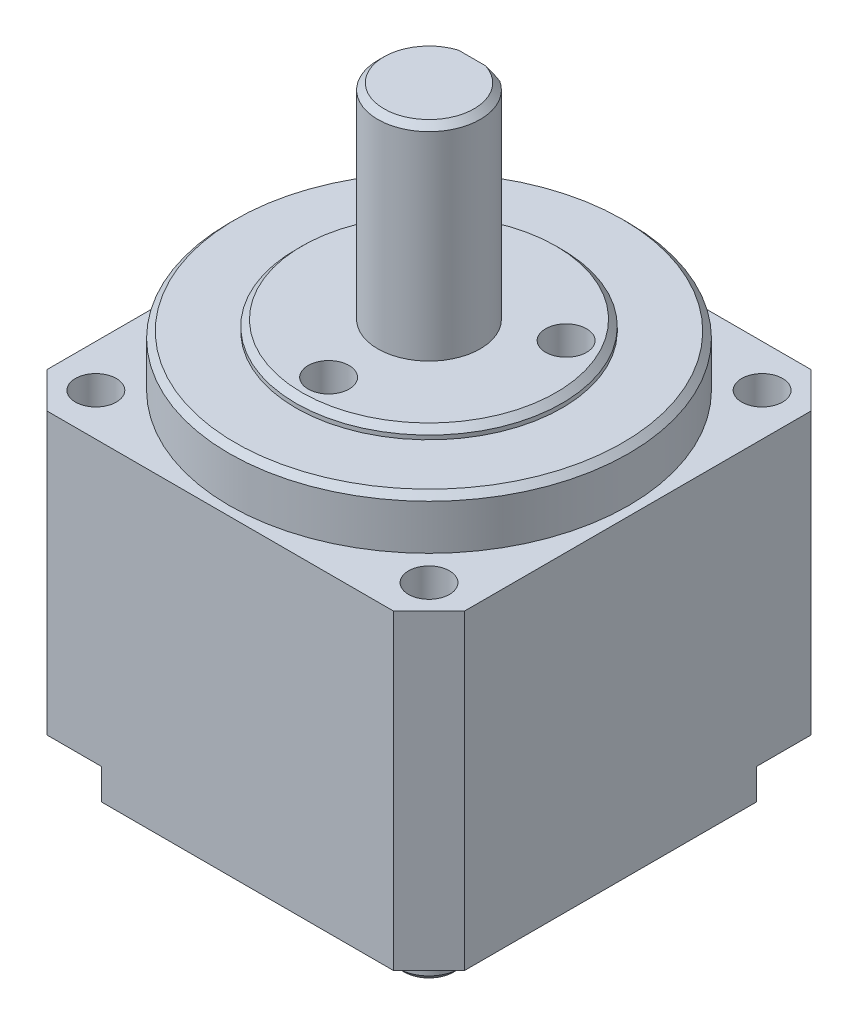
from build123d import *

# Parameters (mm, degrees)
SKETCH_1_W          = 20.4
SKETCH_1_H          = 20.4
EXTRUDE_1_DEPTH     = 15.2
SKETCH_2_R          = 9.75
EXTRUDE_2_DEPTH     = 2.5
SKETCH_3_R          = 6.5
EXTRUDE_3_DEPTH     = 0.5
CHAMFER_1_SIZE      = 0.3
CHAMFER_2_SIZE      = 0.3
SKETCH_4_R          = 2.5
EXTRUDE_4_DEPTH     = 10
SKETCH_5_R          = 4.5
EXTRUDE_5_DEPTH     = 0.8
SKETCH_6_R          = 1.5
EXTRUDE_6_DEPTH     = 8
CHAMFER_3_SIZE      = 0.3
CUT_EXTRUDE_1_DEPTH = 1.5
SKETCH_8_R          = 1
CUT_EXTRUDE_2_DEPTH = 6
SKETCH_9_R          = 1.25
CUT_EXTRUDE_3_DEPTH = 1.5
SKETCH_10_R         = 1
CUT_EXTRUDE_4_DEPTH = 4
SKETCH_11_R         = 0.8
CUT_EXTRUDE_5_DEPTH = 1.2
CHAMFER_4_SIZE      = 1.743
CHAMFER_5_SIZE      = 0.3
CUT_EXTRUDE_START   = -9
CUT_EXTRUDE_6_DEPTH = 9
CUT_EXTRUDE_START_2 = -7
CUT_EXTRUDE_7_DEPTH = 7


with BuildPart() as part:
    # 草图1 → 凸台-拉伸1 (new body)
    with BuildSketch(Plane(origin=(0, 0, 0), x_dir=(1, 0, 0), z_dir=(0, 1, 0))):
        Rectangle(SKETCH_1_W, SKETCH_1_H)
    extrude(amount=EXTRUDE_1_DEPTH)

    # 草图2 → 凸台-拉伸2 (add)
    with BuildSketch(Plane(origin=(0, 15.2, 0), x_dir=(1, 0, 0), z_dir=(0, 1, 0))):
        with Locations(Location((0, 0, 0), (0, 0, 270))):
            Circle(SKETCH_2_R)
    extrude(amount=EXTRUDE_2_DEPTH)

    # 草图3 → 凸台-拉伸3 (add)
    with BuildSketch(Plane(origin=(0, 17.7, 0), x_dir=(1, 0, 0), z_dir=(0, 1, 0))):
        with Locations(Location((0, 0, 0), (0, 0, 270))):
            Circle(SKETCH_3_R)
    extrude(amount=EXTRUDE_3_DEPTH)

    # 倒角1
    chamfer_1_edges = [part.edges().sort_by_distance(p)[0] for p in [
        (0, 18.2, -6.5),
    ]]
    chamfer(chamfer_1_edges, length=CHAMFER_1_SIZE)

    # 倒角2
    chamfer_2_edges = [part.edges().sort_by_distance(p)[0] for p in [
        (0, 17.7, -9.75),
    ]]
    chamfer(chamfer_2_edges, length=CHAMFER_2_SIZE)

    # 草图4 → 凸台-拉伸4 (add)
    with BuildSketch(Plane(origin=(0, 18.2, 0), x_dir=(1, 0, 0), z_dir=(0, 1, 0))):
        with Locations(Location((0, 0, 0), (0, 0, 270))):
            Circle(SKETCH_4_R)
    extrude(amount=EXTRUDE_4_DEPTH)

    # 草图5 → 凸台-拉伸5 (add)
    with BuildSketch(Plane.XZ):
        with Locations(Location((0, 0, 0), (0, 0, 270))):
            Circle(SKETCH_5_R)
    extrude(amount=EXTRUDE_5_DEPTH)

    # 草图6 → 凸台-拉伸6 (add)
    with BuildSketch(Plane.XZ.offset(0.8)):
        with Locations(Location((0, 0, 0), (0, 0, 270))):
            Circle(SKETCH_6_R)
    extrude(amount=EXTRUDE_6_DEPTH)

    # 倒角3
    chamfer_3_edges = [part.edges().sort_by_distance(p)[0] for p in [
        (0, -0.8, 4.5),
        (0, -8.8, 1.5),
    ]]
    chamfer(chamfer_3_edges, length=CHAMFER_3_SIZE)

    # 草图7 → 切除-拉伸1 (cut)
    with BuildSketch(Plane.XZ):
        with BuildLine():
            Line((-10.2, 5.8), (-8.5, 5.8))
            ThreePointArc((-8.5, 5.8), (-6.590811691, 6.590811691), (-5.8, 8.5))
            Line((-5.8, 8.5), (-5.8, 10.2))
            Line((-5.8, 10.2), (-10.2, 10.2))
            Line((-10.2, 10.2), (-10.2, 5.8))
        make_face()
        with BuildLine():
            Line((10.2, -10.2), (10.2, -5.8))
            Line((10.2, -5.8), (8.5, -5.8))
            ThreePointArc((8.5, -5.8), (6.590811691, -6.590811691), (5.8, -8.5))
            Line((5.8, -8.5), (5.8, -10.2))
            Line((5.8, -10.2), (10.2, -10.2))
        make_face()
    extrude(amount=-CUT_EXTRUDE_1_DEPTH, mode=Mode.SUBTRACT)

    # 草图8 → 切除-拉伸2 (cut)
    with BuildSketch(Plane(origin=(0, 15.2, 0), x_dir=(1, 0, 0), z_dir=(0, 1, 0))):
        with Locations(Location((-8.131727984, 8.131727984, 0), (0, 0, 270))):
            Circle(SKETCH_8_R)
        with Locations(Location((8.131727984, 8.131727984, 0), (0, 0, 270))):
            Circle(SKETCH_8_R)
        with Locations(Location((8.131727984, -8.131727984, 0), (0, 0, 270))):
            Circle(SKETCH_8_R)
        with Locations(Location((-8.131727984, -8.131727984, 0), (0, 0, 270))):
            Circle(SKETCH_8_R)
    extrude(amount=-CUT_EXTRUDE_2_DEPTH, mode=Mode.SUBTRACT)

    # 草图9 → 切除-拉伸3 (cut)
    with BuildSketch(Plane(origin=(0, 9.2, 0), x_dir=(1, 0, 0), z_dir=(0, 1, 0))):
        with Locations(Location((8.131727984, -8.131727984, 0), (0, 0, 270))):
            Circle(SKETCH_9_R)
        with Locations(Location((8.131727984, 8.131727984, 0), (0, 0, 270))):
            Circle(SKETCH_9_R)
        with Locations(Location((-8.131727984, 8.131727984, 0), (0, 0, 270))):
            Circle(SKETCH_9_R)
        with Locations(Location((-8.131727984, -8.131727984, 0), (0, 0, 270))):
            Circle(SKETCH_9_R)
    extrude(amount=-CUT_EXTRUDE_3_DEPTH, mode=Mode.SUBTRACT)

    # 草图10 → 切除-拉伸4 (cut)
    with BuildSketch(Plane(origin=(0, 18.2, 0), x_dir=(1, 0, 0), z_dir=(0, 1, 0))):
        with Locations(Location((0, -4.9, 0), (0, 0, 270))):
            Circle(SKETCH_10_R)
        with Locations(Location((-4.243524479, 2.45, 0), (0, 0, 270))):
            Circle(SKETCH_10_R)
        with Locations(Location((4.243524479, 2.45, 0), (0, 0, 270))):
            Circle(SKETCH_10_R)
    extrude(amount=-CUT_EXTRUDE_4_DEPTH, mode=Mode.SUBTRACT)

    # 草图11 → 切除-拉伸5 (cut)
    with BuildSketch(Plane(origin=(0, 14.2, 0), x_dir=(1, 0, 0), z_dir=(0, 1, 0))):
        with Locations(Location((0, -4.9, 0), (0, 0, 270))):
            Circle(SKETCH_11_R)
        with Locations(Location((-4.243524479, 2.45, 0), (0, 0, 270))):
            Circle(SKETCH_11_R)
        with Locations(Location((4.243524479, 2.45, 0), (0, 0, 270))):
            Circle(SKETCH_11_R)
    extrude(amount=-CUT_EXTRUDE_5_DEPTH, mode=Mode.SUBTRACT)

    # 倒角4
    chamfer_4_edges = [part.edges().sort_by_distance(p)[0] for p in [
        (-10.2, 7.6, -10.2),
        (10.2, 8.35, -10.2),
        (10.2, 7.6, 10.2),
        (-10.2, 8.35, 10.2),
    ]]
    chamfer(chamfer_4_edges, length=CHAMFER_4_SIZE)

    # 倒角5
    chamfer_5_edges = [part.edges().sort_by_distance(p)[0] for p in [
        (0, 28.2, -2.5),
    ]]
    chamfer(chamfer_5_edges, length=CHAMFER_5_SIZE)

    # 草图12 → 切除-拉伸6 (cut)
    with BuildSketch(Plane(origin=(0, 28.2, 0), x_dir=(1, 0, 0), z_dir=(0, 1, 0)).offset(CUT_EXTRUDE_START)):
        with BuildLine():
            Line((-1.356465997, 2.1), (1.356465997, 2.1))
            ThreePointArc((1.356465997, 2.1), (0, 2.5), (-1.356465997, 2.1))
        make_face()
    extrude(amount=CUT_EXTRUDE_6_DEPTH, mode=Mode.SUBTRACT)

    # 草图13 → 切除-拉伸7 (cut)
    with BuildSketch(Plane.XZ.offset(8.8).offset(CUT_EXTRUDE_START_2)):
        with BuildLine():
            Line((-1.019803903, -1.1), (1.019803903, -1.1))
            ThreePointArc((1.019803903, -1.1), (0, -1.5), (-1.019803903, -1.1))
        make_face()
    extrude(amount=CUT_EXTRUDE_7_DEPTH, mode=Mode.SUBTRACT)


solid = part.part
